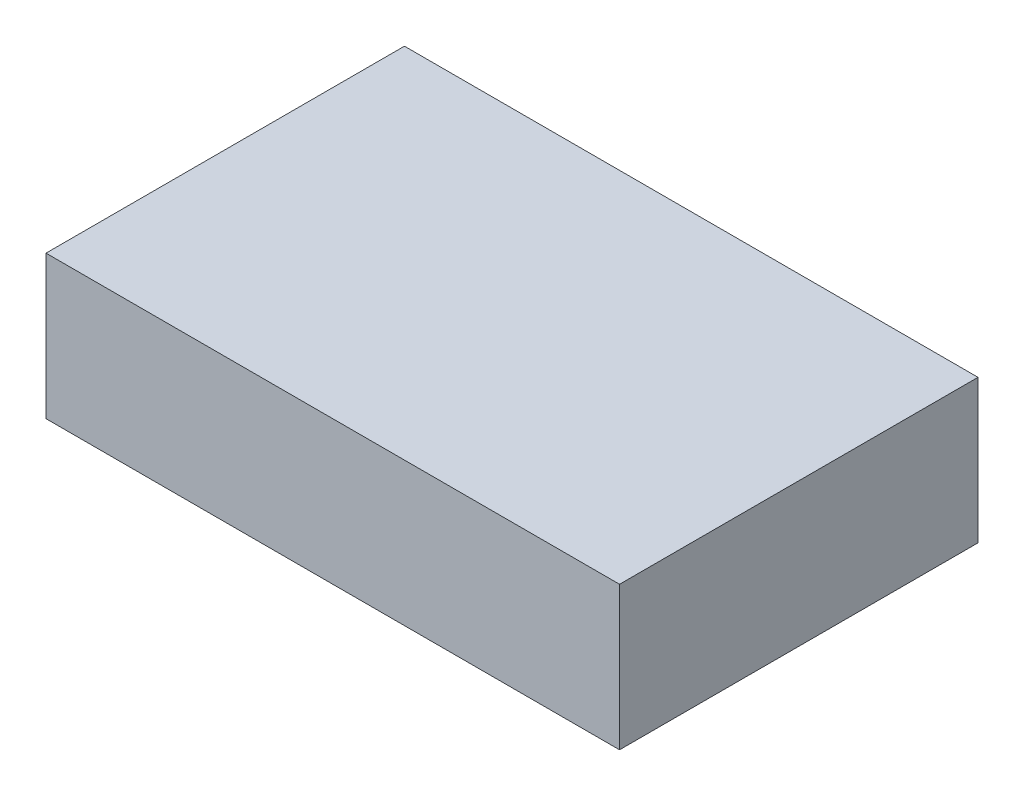
from build123d import *

# Parameters (mm, degrees)
SKETCH1_W      = 101.6
SKETCH1_H      = 63.5
EXTRUDE1_DEPTH = 25.4


with BuildPart() as part:
    # Sketch1 → Extrude1 (new body)
    with BuildSketch(Plane(origin=(0, 0, 0), x_dir=(1, 0, 0), z_dir=(0, 1, 0))):
        with Locations((0, -6.35)):
            Rectangle(SKETCH1_W, SKETCH1_H)
    extrude(amount=-EXTRUDE1_DEPTH)


solid = part.part
